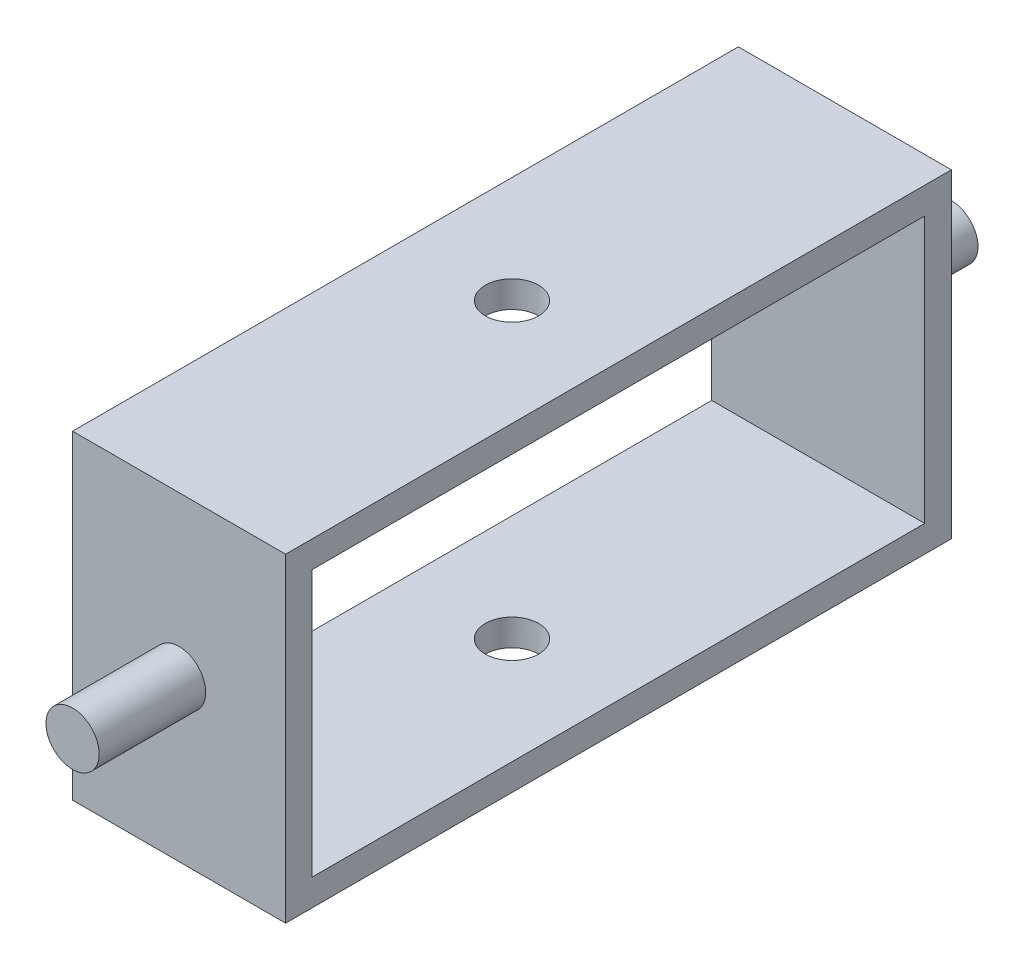
from build123d import *

# Parameters (mm, degrees)
SKETCH_1_R          = 5
EXTRUDE_1_DEPTH     = 20
SKETCH_2_W          = 40
SKETCH_2_H          = 60
EXTRUDE_2_DEPTH     = 5
SKETCH_3_W          = 40
SKETCH_3_H          = 5
EXTRUDE_3_DEPTH     = 115
SKETCH_4_W          = 40
SKETCH_4_H          = 60
EXTRUDE_4_DEPTH     = 5
SKETCH_5_R          = 5
EXTRUDE_5_DEPTH     = 20
SKETCH_6_R          = 5
CUT_EXTRUDE_1_DEPTH = 241


with BuildPart() as part:
    # Эскиз1 → Бобышка-Вытянуть1 (new body)
    with BuildSketch(Plane.XY):
        Circle(SKETCH_1_R)
    extrude(amount=EXTRUDE_1_DEPTH)

    # Эскиз2 → Бобышка-Вытянуть2 (add)
    with BuildSketch(Plane.XY.offset(20)):
        Rectangle(SKETCH_2_W, SKETCH_2_H)
    extrude(amount=EXTRUDE_2_DEPTH)

    # Эскиз3 → Бобышка-Вытянуть3 (add)
    with BuildSketch(Plane.XY.offset(25)):
        with Locations((0, 27.5)):
            Rectangle(SKETCH_3_W, SKETCH_3_H)
        with Locations((0, -27.5)):
            Rectangle(SKETCH_3_W, SKETCH_3_H)
    extrude(amount=EXTRUDE_3_DEPTH)

    # Эскиз4 → Бобышка-Вытянуть4 (add)
    with BuildSketch(Plane.XY.offset(140)):
        Rectangle(SKETCH_4_W, SKETCH_4_H)
    extrude(amount=EXTRUDE_4_DEPTH)

    # Эскиз5 → Бобышка-Вытянуть5 (add)
    with BuildSketch(Plane.XY.offset(145)):
        Circle(SKETCH_5_R)
    extrude(amount=EXTRUDE_5_DEPTH)

    # Эскиз6 → Вырез-Вытянуть1 (cut)
    with BuildSketch(Plane(origin=(0, 30, 0), x_dir=(1, 0, 0), z_dir=(0, 1, 0))):
        with Locations(Location((0, -82.5, 0), (0, 0, 180))):
            Circle(SKETCH_6_R)
    extrude(amount=-CUT_EXTRUDE_1_DEPTH, mode=Mode.SUBTRACT)


solid = part.part
